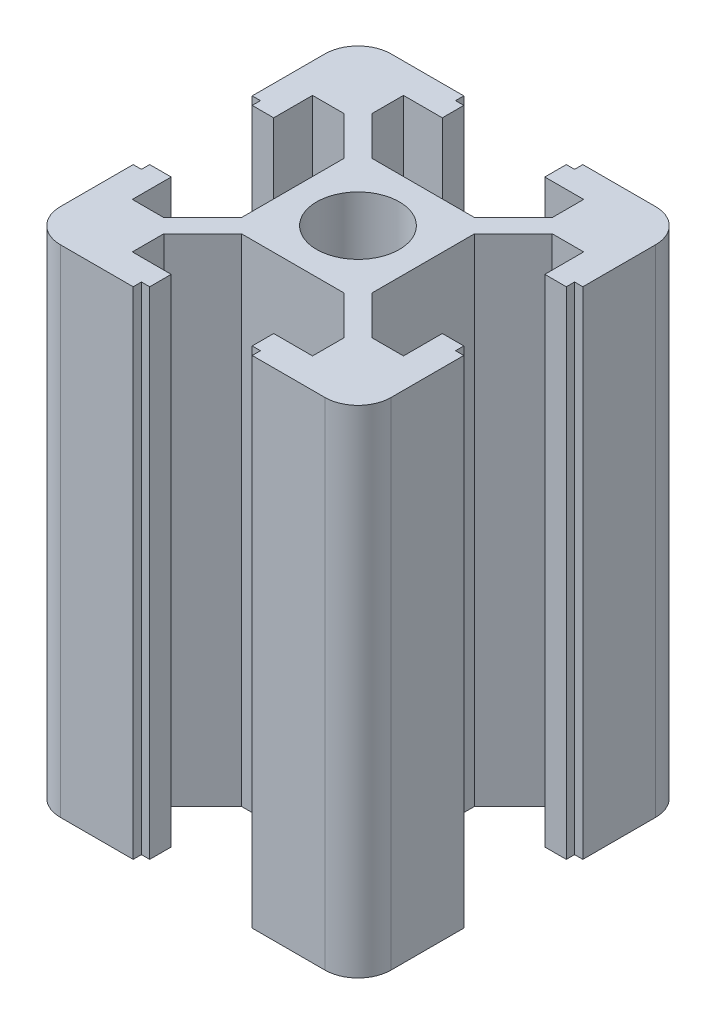
from build123d import *

# Parameters (mm, degrees)
SKETCH_1_R      = 2.5
EXTRUDE_1_DEPTH = 30


with BuildPart() as part:
    # 草图1 → 凸台-拉伸1 (new body)
    with BuildSketch(Plane(origin=(0, 0, 0), x_dir=(1, 0, 0), z_dir=(0, 1, 0))):
        with BuildLine():
            Line((-3.948528137, -3.1), (-6.298528137, -5.45))
            Line((-6.298528137, -5.45), (-8.2, -5.45))
            Line((-8.2, -5.45), (-8.2, -3.1))
            Line((-8.2, -3.1), (-9.5, -3.1))
            Line((-9.5, -3.1), (-9.5, -3.6))
            Line((-9.5, -3.6), (-10, -3.6))
            Line((-10, -3.6), (-10, -8))
            ThreePointArc((-10, -8), (-9.414213562, -9.414213562), (-8, -10))
            Line((-8, -10), (-3.6, -10))
            Line((-3.6, -10), (-3.6, -9.5))
            Line((-3.6, -9.5), (-3.1, -9.5))
            Line((-3.1, -9.5), (-3.1, -8.2))
            Line((-3.1, -8.2), (-5.45, -8.2))
            Line((-5.45, -8.2), (-5.45, -6.298528137))
            Line((-5.45, -6.298528137), (-3.1, -3.948528137))
            Line((-3.1, -3.948528137), (0, -3.948528137))
            Line((0, -3.948528137), (3.1, -3.948528137))
            Line((3.1, -3.948528137), (5.45, -6.298528137))
            Line((5.45, -6.298528137), (5.45, -8.2))
            Line((5.45, -8.2), (3.1, -8.2))
            Line((3.1, -8.2), (3.1, -9.5))
            Line((3.1, -9.5), (3.6, -9.5))
            Line((3.6, -9.5), (3.6, -10))
            Line((3.6, -10), (8, -10))
            ThreePointArc((8, -10), (9.414213562, -9.414213562), (10, -8))
            Line((10, -8), (10, -3.6))
            Line((10, -3.6), (9.5, -3.6))
            Line((9.5, -3.6), (9.5, -3.1))
            Line((9.5, -3.1), (8.2, -3.1))
            Line((8.2, -3.1), (8.2, -5.45))
            Line((8.2, -5.45), (6.298528137, -5.45))
            Line((6.298528137, -5.45), (3.948528137, -3.1))
            Line((3.948528137, -3.1), (3.948528137, 0))
            Line((3.948528137, 0), (3.948528137, 3.1))
            Line((3.948528137, 3.1), (6.298528137, 5.45))
            Line((6.298528137, 5.45), (8.2, 5.45))
            Line((8.2, 5.45), (8.2, 3.1))
            Line((8.2, 3.1), (9.5, 3.1))
            Line((9.5, 3.1), (9.5, 3.6))
            Line((9.5, 3.6), (10, 3.6))
            Line((10, 3.6), (10, 8))
            ThreePointArc((10, 8), (9.414213562, 9.414213562), (8, 10))
            Line((8, 10), (3.6, 10))
            Line((3.6, 10), (3.6, 9.5))
            Line((3.6, 9.5), (3.1, 9.5))
            Line((3.1, 9.5), (3.1, 8.2))
            Line((3.1, 8.2), (5.45, 8.2))
            Line((5.45, 8.2), (5.45, 6.298528137))
            Line((5.45, 6.298528137), (3.1, 3.948528137))
            Line((3.1, 3.948528137), (0, 3.948528137))
            Line((0, 3.948528137), (-3.1, 3.948528137))
            Line((-3.1, 3.948528137), (-5.45, 6.298528137))
            Line((-5.45, 6.298528137), (-5.45, 8.2))
            Line((-5.45, 8.2), (-3.1, 8.2))
            Line((-3.1, 8.2), (-3.1, 9.5))
            Line((-3.1, 9.5), (-3.6, 9.5))
            Line((-3.6, 9.5), (-3.6, 10))
            Line((-3.6, 10), (-8, 10))
            ThreePointArc((-8, 10), (-9.414213562, 9.414213562), (-10, 8))
            Line((-10, 8), (-10, 3.6))
            Line((-10, 3.6), (-9.5, 3.6))
            Line((-9.5, 3.6), (-9.5, 3.1))
            Line((-9.5, 3.1), (-8.2, 3.1))
            Line((-8.2, 3.1), (-8.2, 5.45))
            Line((-8.2, 5.45), (-6.298528137, 5.45))
            Line((-6.298528137, 5.45), (-3.948528137, 3.1))
            Line((-3.948528137, 3.1), (-3.948528137, 0))
            Line((-3.948528137, 0), (-3.948528137, -3.1))
        make_face()
        with Locations(Location((0, 0, 0), (0, 0, 270))):
            Circle(SKETCH_1_R, mode=Mode.SUBTRACT)
    extrude(amount=EXTRUDE_1_DEPTH)


solid = part.part
